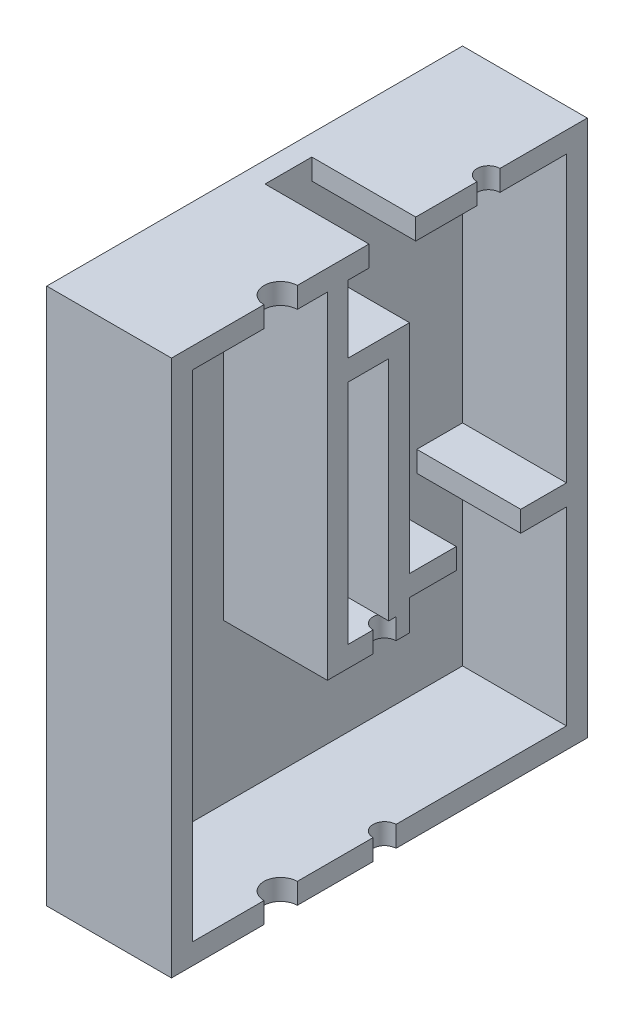
from build123d import *

# Parameters (mm, degrees)
SKETCH_1_W                      = 40
SKETCH_1_H                      = 51.65
EXTRUDE_1_DEPTH                 = 12
SHELL_1_T                       = -2
SKETCH_3_W                      = 3.9
SKETCH_3_H                      = 21.85
SKETCH_3_W_2                    = 4.4
SKETCH_3_H_2                    = 2
EXTRUDE_6_DEPTH                 = 10
CUT_EXTRUDE_1_REACH             = 58.672
SKETCH_4_R                      = 1.1
SKETCH_4_R_2                    = 1.6
SKETCH_4_W                      = 10
SKETCH_4_H                      = 4.5
CUT_EXTRUDE_1_DIRECTION_2_DEPTH = 57.672061018
CUT_EXTRUDE_START               = -19.3
SKETCH_6_R                      = 1.1
SKETCH_6_R_2                    = 1.6
CUT_EXTRUDE_4_DEPTH             = 19.3


with BuildPart() as part:
    # 草图1 → 凸台-拉伸1 (new body)
    with BuildSketch(Plane(origin=(0, 0, 0), x_dir=(0, 0, -1), z_dir=(1, 0, 0))):
        Rectangle(SKETCH_1_W, SKETCH_1_H)
    extrude(amount=EXTRUDE_1_DEPTH)

    # 抽壳1
    shell_1_openings = [part.faces().sort_by_distance(p)[0] for p in [
        (12, 0, 0),
    ]]
    offset(amount=SHELL_1_T, openings=shell_1_openings, kind=Kind.INTERSECTION)

    # 草图3 → 凸台-拉伸6 (add)
    # profile 1 of 2: a face of its own
    with BuildSketch(Plane(origin=(2, 0, 0), x_dir=(0, 0, -1), z_dir=(1, 0, 0))):
        Polygon((2.9, -8.525), (-5, -8.525), (-5, 23.825), (-3, 23.825), (-3, 17.325), (2.9, 17.325), (2.9, -3.575), (7.4, -3.575), (7.4, -5.575), (2.9, -5.575), align=None)
        with Locations((-1.05, 4.4)):
            Rectangle(SKETCH_3_W, SKETCH_3_H, mode=Mode.SUBTRACT)
    # profile 2 of 2: a face of its own
    with BuildSketch(Plane(origin=(2, 0, 0), x_dir=(0, 0, -1), z_dir=(1, 0, 0))):
        with Locations((15.8, -4.575)):
            Rectangle(SKETCH_3_W_2, SKETCH_3_H_2)
    extrude(amount=EXTRUDE_6_DEPTH)

    # 草图4 → 切除-拉伸1 (cut, up to next)
    with BuildSketch(Plane(origin=(0, 25.825, 0), x_dir=(1, 0, 0), z_dir=(0, 1, 0)), mode=Mode.PRIVATE) as cut_extrude_1_sk1:
        with Locations((12, 10.5)):
            Circle(SKETCH_4_R)
    cut_extrude_1_tool1 = extrude(cut_extrude_1_sk1.sketch, amount=-CUT_EXTRUDE_1_REACH, mode=Mode.PRIVATE) & part.part
    # 草图4 → 切除-拉伸1 (cut, up to next)
    with BuildSketch(Plane(origin=(0, 25.825, 0), x_dir=(1, 0, 0), z_dir=(0, 1, 0)), mode=Mode.PRIVATE) as cut_extrude_1_sk2:
        with Locations((12, -9.5)):
            Circle(SKETCH_4_R_2)
    cut_extrude_1_tool2 = extrude(cut_extrude_1_sk2.sketch, amount=-CUT_EXTRUDE_1_REACH, mode=Mode.PRIVATE) & part.part
    # 草图4 → 切除-拉伸1 (cut, up to next)
    with BuildSketch(Plane(origin=(0, 25.825, 0), x_dir=(1, 0, 0), z_dir=(0, 1, 0)), mode=Mode.PRIVATE) as cut_extrude_1_sk3:
        with Locations((7, 1.25)):
            Rectangle(SKETCH_4_W, SKETCH_4_H)
    cut_extrude_1_tool3 = extrude(cut_extrude_1_sk3.sketch, amount=-CUT_EXTRUDE_1_REACH, mode=Mode.PRIVATE) & part.part
    add(cut_extrude_1_tool1.solids().sort_by_distance((12, 25.825, -10.5))[0], mode=Mode.SUBTRACT)
    add(cut_extrude_1_tool2.solids().sort_by_distance((12, 25.825, 9.5))[0], mode=Mode.SUBTRACT)
    add(cut_extrude_1_tool3.solids().sort_by_distance((7, 25.825, -1.25))[0], mode=Mode.SUBTRACT)

    # 草图4 → 切除-拉伸1 direction 2 (cut)
    with BuildSketch(Plane(origin=(0, 25.825, 0), x_dir=(1, 0, 0), z_dir=(0, 1, 0))):
        with Locations((12, 10.5)):
            Circle(SKETCH_4_R)
        with Locations((12, -9.5)):
            Circle(SKETCH_4_R_2)
        with Locations((7, 1.25)):
            Rectangle(SKETCH_4_W, SKETCH_4_H)
    extrude(amount=CUT_EXTRUDE_1_DIRECTION_2_DEPTH, mode=Mode.SUBTRACT)

    # 草图6 → 切除-拉伸4 (cut)
    with BuildSketch(Plane.XZ.offset(25.825).offset(CUT_EXTRUDE_START)):
        with Locations((12, -0.5)):
            Circle(SKETCH_6_R)
        with Locations((12, 9.5)):
            Circle(SKETCH_6_R_2)
    extrude(amount=CUT_EXTRUDE_4_DEPTH, mode=Mode.SUBTRACT)


solid = part.part
